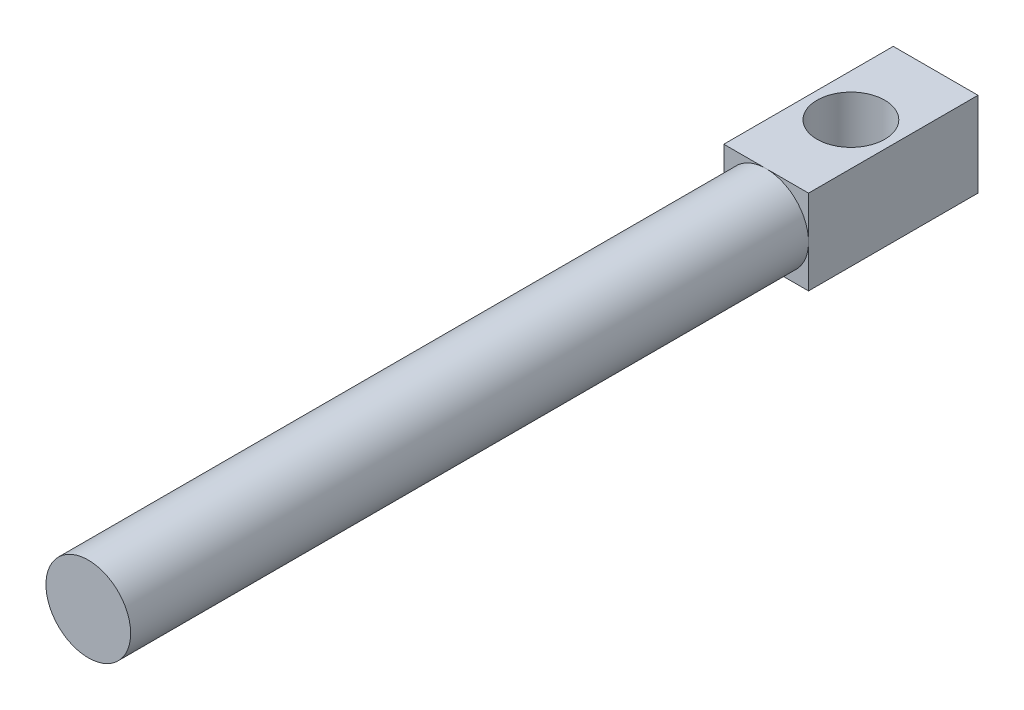
from build123d import *

# Parameters (mm, degrees)
SKETCH1_R           = 7.5
BOSS_EXTRUDE1_DEPTH = 150
SKETCH4_W           = 15
SKETCH4_H           = 30
BOSS_EXTRUDE2_DEPTH = 7.5
SKETCH5_R           = 6
CUT_EXTRUDE2_DEPTH  = 151.934588481


with BuildPart() as part:
    # Sketch1 → Boss-Extrude1 (new body)
    with BuildSketch(Plane.XY):
        Circle(SKETCH1_R)
    extrude(amount=BOSS_EXTRUDE1_DEPTH)

    # Sketch4 → Boss-Extrude2 (add, symmetric)
    with BuildSketch(Plane(origin=(0, 0, 0), x_dir=(1, 0, 0), z_dir=(0, 1, 0))):
        with Locations((0, -15)):
            Rectangle(SKETCH4_W, SKETCH4_H)
    extrude(amount=BOSS_EXTRUDE2_DEPTH, both=True)

    # Sketch5 → Cut-Extrude2 (cut, through all)
    with BuildSketch(Plane(origin=(0, 7.5, 0), x_dir=(1, 0, 0), z_dir=(0, 1, 0))):
        with Locations(Location((0, -15, 0), (0, 0, 270))):
            Circle(SKETCH5_R)
    extrude(amount=-CUT_EXTRUDE2_DEPTH, mode=Mode.SUBTRACT)


solid = part.part
